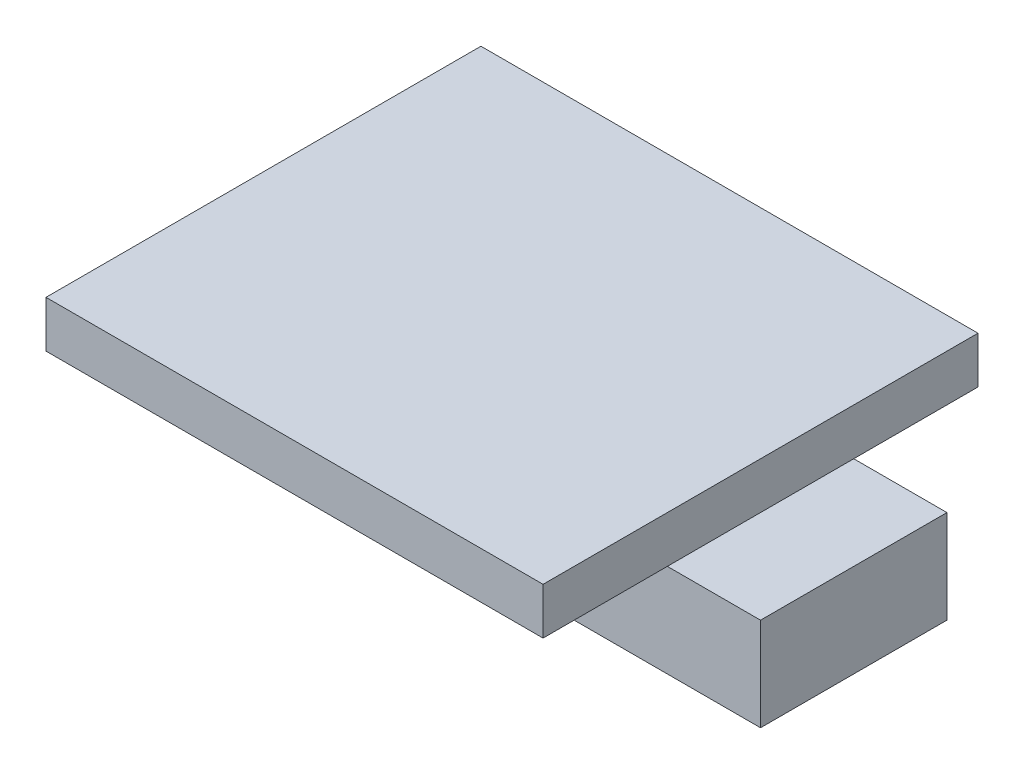
from build123d import *

# Parameters (mm, degrees)
SKETCH_1_W      = 160
SKETCH_1_H      = 140
EXTRUDE_1_DEPTH = 15
SKETCH_3_W      = 60
SKETCH_3_H      = 60
EXTRUDE_2_DEPTH = 30


with BuildPart() as part:
    # 草图1 → 凸台-拉伸1 (new body)
    with BuildSketch(Plane(origin=(0, 0, 0), x_dir=(1, 0, 0), z_dir=(0, 1, 0))):
        Rectangle(SKETCH_1_W, SKETCH_1_H)
    extrude(amount=EXTRUDE_1_DEPTH)

    # 草图3 → 凸台-拉伸2 (add)
    with BuildSketch(Plane.XZ):
        with Locations((80, 0)):
            Rectangle(SKETCH_3_W, SKETCH_3_H)
    extrude(amount=EXTRUDE_2_DEPTH)


solid = part.part
